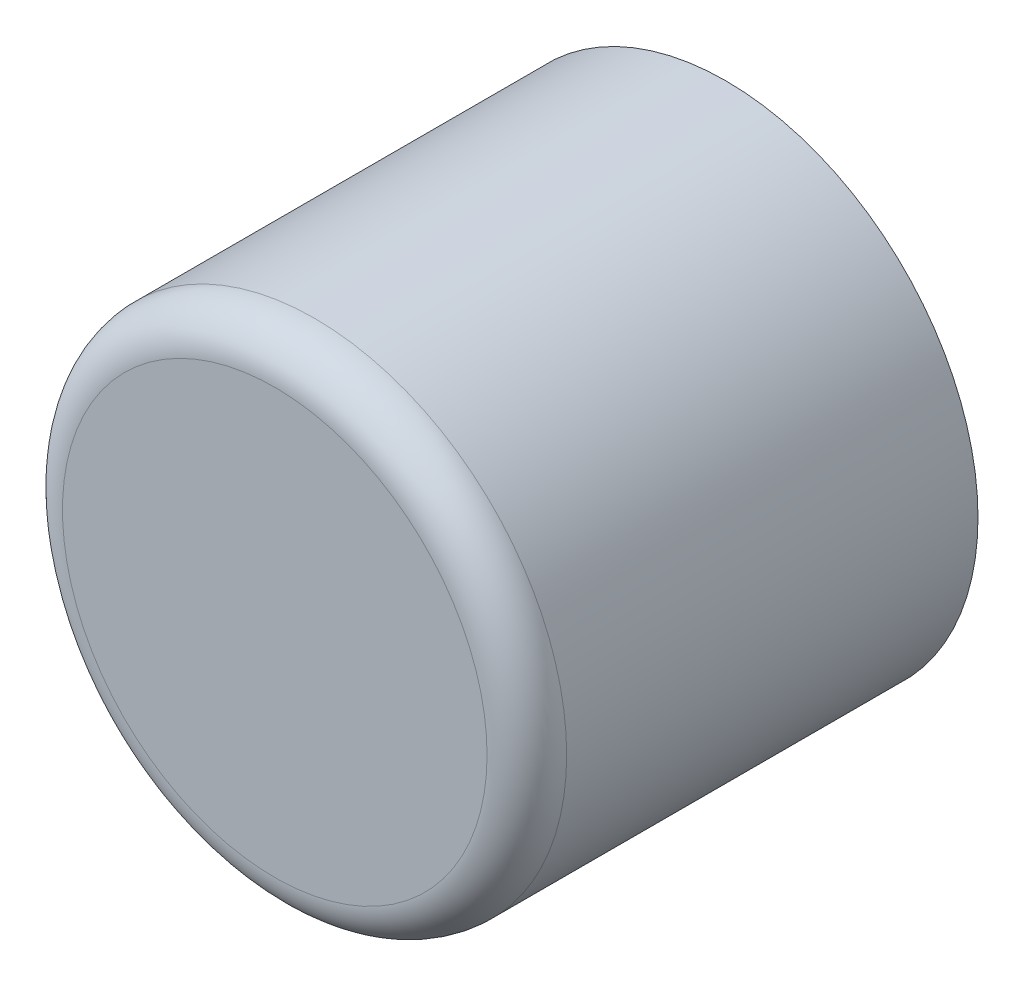
from build123d import *

# Parameters (mm, degrees)
SKETCH_1_R      = 19
EXTRUDE_1_DEPTH = 34
FILLET_1_R      = 3


with BuildPart() as part:
    # 草图1 → 凸台-拉伸1 (new body)
    with BuildSketch(Plane.XY):
        Circle(SKETCH_1_R)
    extrude(amount=EXTRUDE_1_DEPTH)

    # 圆角1
    fillet_1_edges = [part.edges().sort_by_distance(p)[0] for p in [
        (-19, 0, 34),
    ]]
    fillet(fillet_1_edges, radius=FILLET_1_R)


solid = part.part
